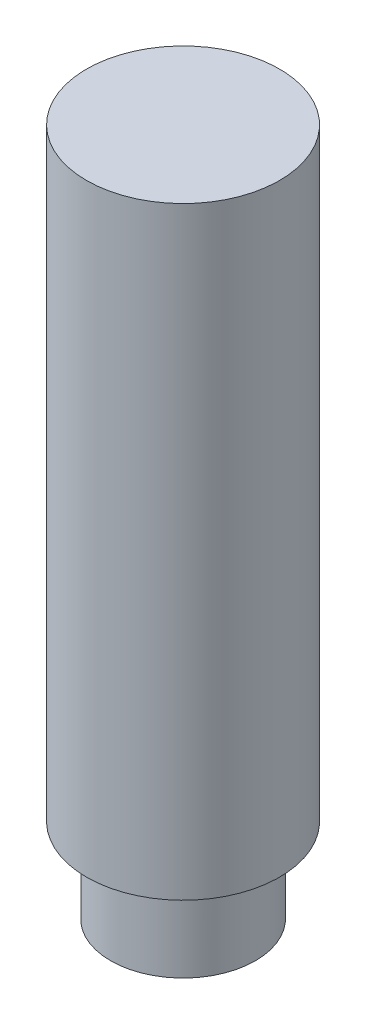
from build123d import *

# Parameters (mm, degrees)
SKETCH_1_R      = 4
EXTRUDE_1_DEPTH = 25
SKETCH_2_R      = 3
EXTRUDE_2_DEPTH = 3.5


with BuildPart() as part:
    # Эскиз1 → Бобышка-Вытянуть1 (new body)
    with BuildSketch(Plane(origin=(0, 0, 0), x_dir=(1, 0, 0), z_dir=(0, 1, 0))):
        with Locations(Location((0, 0, 0), (0, 0, 270))):
            Circle(SKETCH_1_R)
    extrude(amount=EXTRUDE_1_DEPTH)

    # Эскиз2 → Бобышка-Вытянуть2 (add)
    with BuildSketch(Plane.XZ):
        with Locations(Location((0, 0, 0), (0, 0, 90))):
            Circle(SKETCH_2_R)
    extrude(amount=EXTRUDE_2_DEPTH)


solid = part.part
